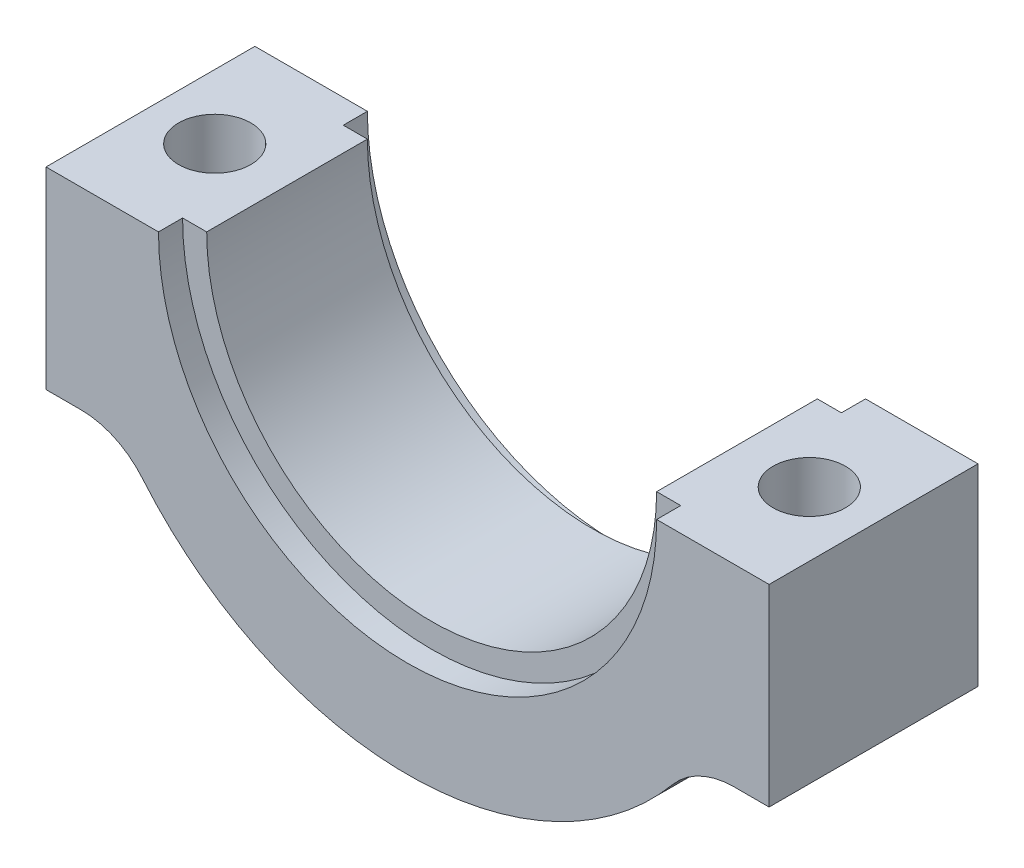
from build123d import *

# Parameters (mm, degrees)
EXTRUDE_1_DEPTH          = 13
SKETCH_3_R               = 31
CUT_EXTRUDE_1_DEPTH      = 3
CUT_EXTRUDE_3_DEPTH      = 53.630789468
CUT_EXTRUDE_3_DEPTH_BACK = 5
SKETCH_9_R               = 7
SKETCH_10_R              = 4.5
CUT_EXTRUDE_4_DEPTH      = 53.630789538


with BuildPart() as part:
    # Эскиз1 → Бобышка-Вытянуть1 (new, symmetric)
    with BuildSketch(Plane.XY):
        with BuildLine():
            Line((-28, 0), (-45, 0))
            Line((-45, 0), (-45, -24))
            Line((-45, -24), (-40.657102701, -24))
            ThreePointArc((-40.657102701, -24), (-36.423365781, -24.940448593), (-32.985951248, -27.58490566))
            ThreePointArc((-32.985951248, -27.58490566), (0, -43), (32.985951248, -27.58490566))
            ThreePointArc((32.985951248, -27.58490566), (36.423365781, -24.940448593), (40.657102701, -24))
            Line((40.657102701, -24), (45, -24))
            Line((45, -24), (45, 0))
            Line((45, 0), (28, 0))
            ThreePointArc((28, 0), (0, -28), (-28, 0))
        make_face()
    extrude(amount=EXTRUDE_1_DEPTH, both=True)

    # Эскиз3 → Вырез-Вытянуть1 (cut)
    with BuildSketch(Plane.XY.offset(-13)):
        Circle(SKETCH_3_R)
    cut_extrude_1 = extrude(amount=CUT_EXTRUDE_1_DEPTH, mode=Mode.SUBTRACT)

    # Зеркальное отражение2: Вырез-Вытянуть1 across plane
    add(cut_extrude_1.mirror(Plane.XY), mode=Mode.SUBTRACT)

    # Эскиз9 → Вырез-Вытянуть3 (cut, two sides: drawn at the far end of the back side and taken through both)
    with BuildSketch(Plane.XZ.offset(24).offset(-CUT_EXTRUDE_3_DEPTH_BACK)):
        with Locations((-37, 0)):
            Circle(SKETCH_9_R)
        with Locations((37, 0)):
            Circle(SKETCH_9_R)
    extrude(amount=CUT_EXTRUDE_3_DEPTH + CUT_EXTRUDE_3_DEPTH_BACK, mode=Mode.SUBTRACT)

    # Эскиз10 → Вырез-Вытянуть4 (cut, through all)
    with BuildSketch(Plane.XZ.offset(19)):
        with Locations((-37, 0)):
            Circle(SKETCH_10_R)
        with Locations((37, 0)):
            Circle(SKETCH_10_R)
    extrude(amount=-CUT_EXTRUDE_4_DEPTH, mode=Mode.SUBTRACT)


solid = part.part
